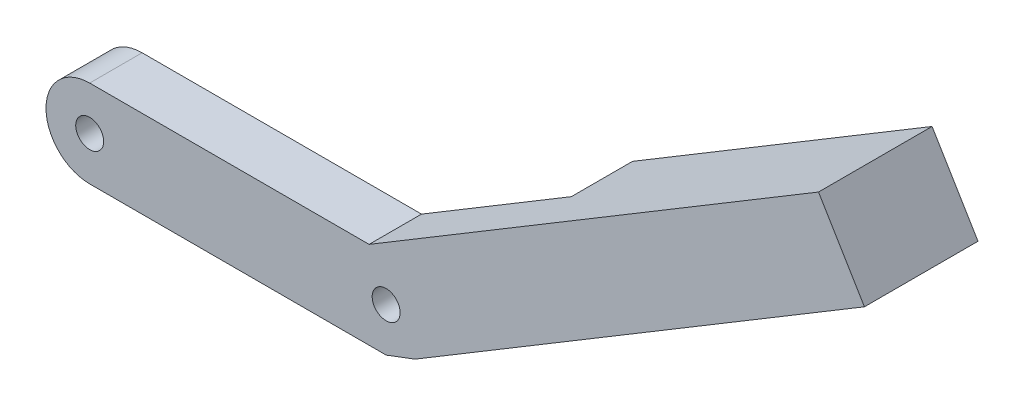
from build123d import *

# Parameters (mm, degrees)
SKETCH1_R               = 1.6
BOSS_EXTRUDE1_DEPTH     = 6
SALIENTE_EXTRUIR1_START = -6
SALIENTE_EXTRUIR1_DEPTH = 7


with BuildPart() as part:
    # Sketch1 → Boss-Extrude1 (new body)
    # profile 1 of 2: a face of its own
    with BuildSketch(Plane.XY):
        with BuildLine():
            Line((31.98, 5), (0, 5))
            ThreePointArc((0, 5), (-5, 0), (0, -5))
            Line((0, -5), (33.93, -5))
            Line((33.93, -5), (37.237412205, -3.749803263))
            ThreePointArc((37.237412205, -3.749803263), (38.607019153, 1.767906062), (33.93, 5))
            Line((33.93, 5), (31.98, 5))
        make_face()
        Circle(SKETCH1_R, mode=Mode.SUBTRACT)
        with Locations((33.93, 0)):
            Circle(SKETCH1_R, mode=Mode.SUBTRACT)
    # profile 2 of 2: a face of its own
    with BuildSketch(Plane.XY):
        with BuildLine():
            Line((83.410038042, 35.902284495), (31.98, 5))
            Line((31.98, 5), (33.93, 5))
            ThreePointArc((33.93, 5), (38.607019153, 1.767906062), (37.237412205, -3.749803263))
            Line((37.237412205, -3.749803263), (88.667450247, 27.152481232))
            Line((88.667450247, 27.152481232), (83.410038042, 35.902284495))
        make_face()
    extrude(amount=BOSS_EXTRUDE1_DEPTH)

    # Croquis3 → Saliente-Extruir1 (add)
    with BuildSketch(Plane.XY.offset(6).offset(SALIENTE_EXTRUIR1_START)):
        Polygon((83.410038042, 35.902284495), (88.667450247, 27.152481232), (54.380758219, 6.550958236), (49.123346014, 15.300761498), align=None)
    extrude(amount=-SALIENTE_EXTRUIR1_DEPTH)


solid = part.part
